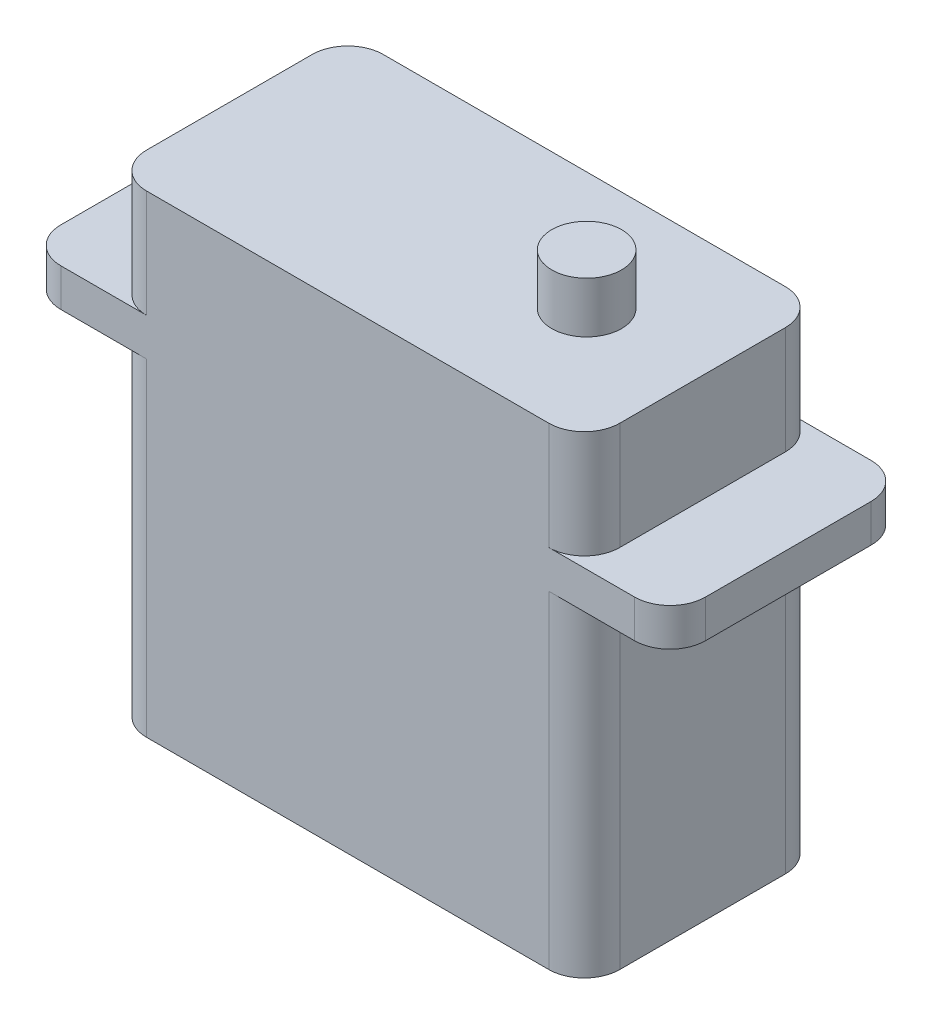
from build123d import *

# Parameters (mm, degrees)
SKETCH1_W           = 40
SKETCH1_H           = 20
BOSS_EXTRUDE1_DEPTH = 40
SKETCH2_W           = 54.5
SKETCH2_H           = 3.2
BOSS_EXTRUDE2_DEPTH = 20
FILLET1_R           = 3
SKETCH3_R           = 2.95
BOSS_EXTRUDE3_DEPTH = 4.3
SCALE1_SCALE        = 1.025


with BuildPart() as part:
    # Sketch1 → Boss-Extrude1 (new body)
    with BuildSketch(Plane(origin=(0, 0, 0), x_dir=(1, 0, 0), z_dir=(0, 1, 0))):
        Rectangle(SKETCH1_W, SKETCH1_H)
    extrude(amount=BOSS_EXTRUDE1_DEPTH)

    # Sketch2 → Boss-Extrude2 (add)
    with BuildSketch(Plane.XY.offset(10)):
        with Locations((0, 29.3)):
            Rectangle(SKETCH2_W, SKETCH2_H)
    extrude(amount=-BOSS_EXTRUDE2_DEPTH)

    # Fillet1
    fillet1_edges = [part.edges().sort_by_distance(p)[0] for p in [
        (20, 13.85, 10),
        (-20, 13.85, 10),
        (-20, 13.85, -10),
        (20, 13.85, -10),
        (27.25, 29.3, 10),
        (27.25, 29.3, -10),
        (-27.25, 29.3, -10),
        (-27.25, 29.3, 10),
        (20, 35.45, 10),
        (-20, 35.45, 10),
        (-20, 35.45, -10),
        (20, 35.45, -10),
    ]]
    fillet(fillet1_edges, radius=FILLET1_R)

    # Sketch3 → Boss-Extrude3 (add)
    with BuildSketch(Plane(origin=(0, 40, 0), x_dir=(1, 0, 0), z_dir=(0, 1, 0))):
        with Locations(Location((10.2, 0, 0), (0, 0, 90))):
            Circle(SKETCH3_R)
    extrude(amount=BOSS_EXTRUDE3_DEPTH)


with BuildPart() as part_1:
    # Scale1: scaled about (0.036629402, 20.343175324, 0)
    add(part.part.scale(SCALE1_SCALE).moved(Location((-0.000915735, -0.508579383, 0))))


solid = part_1.part
